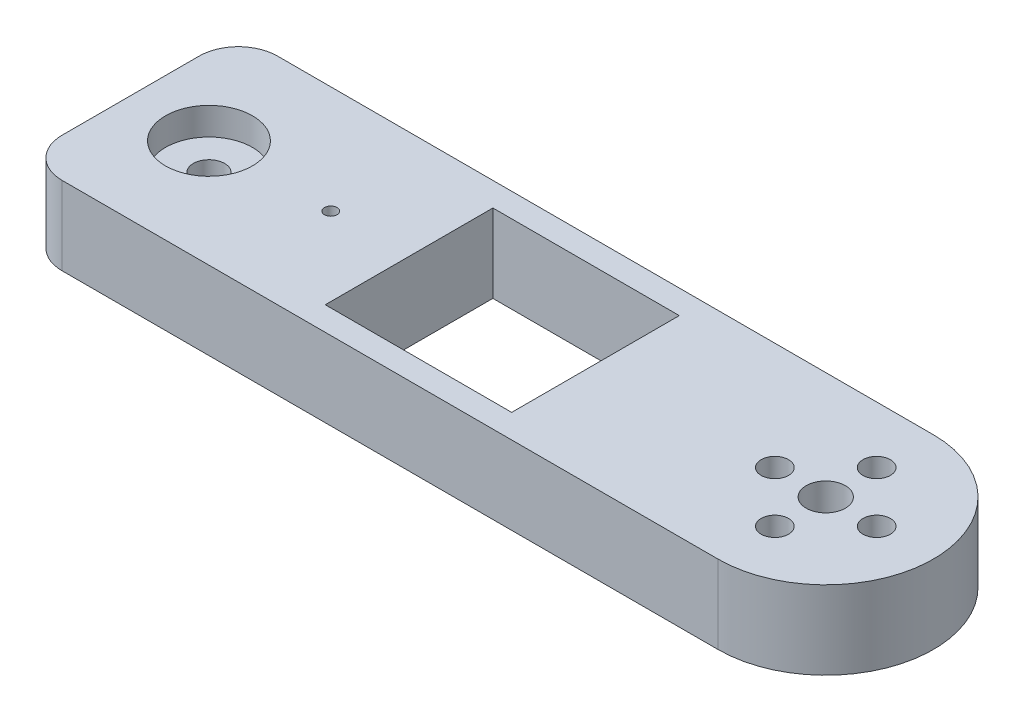
from build123d import *

# Parameters (mm, degrees)
SKETCH1_W             = 150
SKETCH1_H             = 55
BOSS_EXTRUDE1_DEPTH   = 20
SKETCH2_W             = 27.5
SKETCH2_H             = 55
BOSS_EXTRUDE2_DEPTH   = 20
M8_CLEARANCE_HOLE1_D  = 10
M6_CLEARANCE_HOLE1_D  = 7
FILLET1_R             = 10
SKETCH11_W            = 42.4
SKETCH11_H            = 42.4
CUT_EXTRUDE1_DEPTH    = 108.993055332
SKETCH12_R            = 4
CUT_EXTRUDE2_DEPTH    = 108.993055332
SKETCH13_W            = 47.6
SKETCH13_H            = 42.8
CUT_EXTRUDE3_DEPTH    = 108.993055332
CUT_EXTRUDE4_DEPTH    = 6.5
SKETCH15_R            = 11.1
CUT_EXTRUDE5_DEPTH    = 7
F_3_0MM_DOWEL_HOLE1_D = 3.2


with BuildPart() as part:
    # Sketch1 → Boss-Extrude1 (new body)
    with BuildSketch(Plane(origin=(0, 0, 0), x_dir=(1, 0, 0), z_dir=(0, 1, 0))):
        Rectangle(SKETCH1_W, SKETCH1_H)
    extrude(amount=BOSS_EXTRUDE1_DEPTH)

    # Sketch2 → Boss-Extrude2 (add)
    with BuildSketch(Plane.XZ):
        with Locations((-88.75, 0)):
            Rectangle(SKETCH2_W, SKETCH2_H)
        with BuildLine():
            Line((75, 27.5), (75, -27.5))
            ThreePointArc((75, -27.5), (102.5, 0), (75, 27.5))
        make_face()
    extrude(amount=-BOSS_EXTRUDE2_DEPTH)

    # M8 Clearance Hole1 (through all)
    with Locations(Plane(origin=(0, 0, 0), x_dir=(-1, 0, 0), z_dir=(0, -1, 0))):
        with Locations((-75, 0)):
            Hole(M8_CLEARANCE_HOLE1_D / 2)

    # M6 Clearance Hole1 (through all)
    with Locations(Plane(origin=(0, 20, 0), x_dir=(1, 0, 0), z_dir=(0, 1, 0))):
        with Locations((75, 13), (62, 0), (88, 0), (75, -13)):
            Hole(M6_CLEARANCE_HOLE1_D / 2)

    # Fillet1
    fillet1_edges = [part.edges().sort_by_distance(p)[0] for p in [
        (-102.5, 10, -27.5),
        (-102.5, 10, 27.5),
    ]]
    fillet(fillet1_edges, radius=FILLET1_R)

    # Sketch11 → Cut-Extrude1 (cut, through all)
    with BuildSketch(Plane.XZ):
        with Locations((-10, 0)):
            Rectangle(SKETCH11_W, SKETCH11_H)
    extrude(amount=-CUT_EXTRUDE1_DEPTH, mode=Mode.SUBTRACT)

    # Sketch12 → Cut-Extrude2 (cut, through all)
    with BuildSketch(Plane(origin=(0, 20, 0), x_dir=(1, 0, 0), z_dir=(0, 1, 0))):
        with Locations(Location((-82.5, 0, 0), (0, 0, 270))):
            Circle(SKETCH12_R)
    extrude(amount=-CUT_EXTRUDE2_DEPTH, mode=Mode.SUBTRACT)

    # Sketch13 → Cut-Extrude3 (cut, through all)
    with BuildSketch(Plane.XZ):
        with Locations((-7.6, 0)):
            Rectangle(SKETCH13_W, SKETCH13_H)
    extrude(amount=-CUT_EXTRUDE3_DEPTH, mode=Mode.SUBTRACT)

    # Sketch14 → Cut-Extrude4 (cut)
    with BuildSketch(Plane.XZ):
        Polygon((93.969119661, 3.446272843), (88, 6.892545686), (82.030880339, 3.446272843), (82.030880339, -3.446272843), (88, -6.892545686), (93.969119661, -3.446272843), align=None)
        Polygon((71.553727157, 18.969119661), (68.107454314, 13), (71.553727157, 7.030880339), (78.446272843, 7.030880339), (81.892545686, 13), (78.446272843, 18.969119661), align=None)
        Polygon((78.446272843, -18.969119661), (81.892545686, -13), (78.446272843, -7.030880339), (71.553727157, -7.030880339), (68.107454314, -13), (71.553727157, -18.969119661), align=None)
        Polygon((56.030880339, -3.446272843), (62, -6.892545686), (67.969119661, -3.446272843), (67.969119661, 3.446272843), (62, 6.892545686), (56.030880339, 3.446272843), align=None)
    extrude(amount=-CUT_EXTRUDE4_DEPTH, mode=Mode.SUBTRACT)

    # Sketch15 → Cut-Extrude5 (cut)
    with BuildSketch(Plane(origin=(0, 20, 0), x_dir=(1, 0, 0), z_dir=(0, 1, 0))):
        with Locations(Location((-82.5, 0, 0), (0, 0, 270))):
            Circle(SKETCH15_R)
    extrude(amount=-CUT_EXTRUDE5_DEPTH, mode=Mode.SUBTRACT)

    # Ø3.0mm Dowel Hole1 (through all)
    with Locations(Plane(origin=(0, 0, 0), x_dir=(-1, 0, 0), z_dir=(0, -1, 0))):
        with Locations((51.4, 0)):
            Hole(F_3_0MM_DOWEL_HOLE1_D / 2)


solid = part.part
